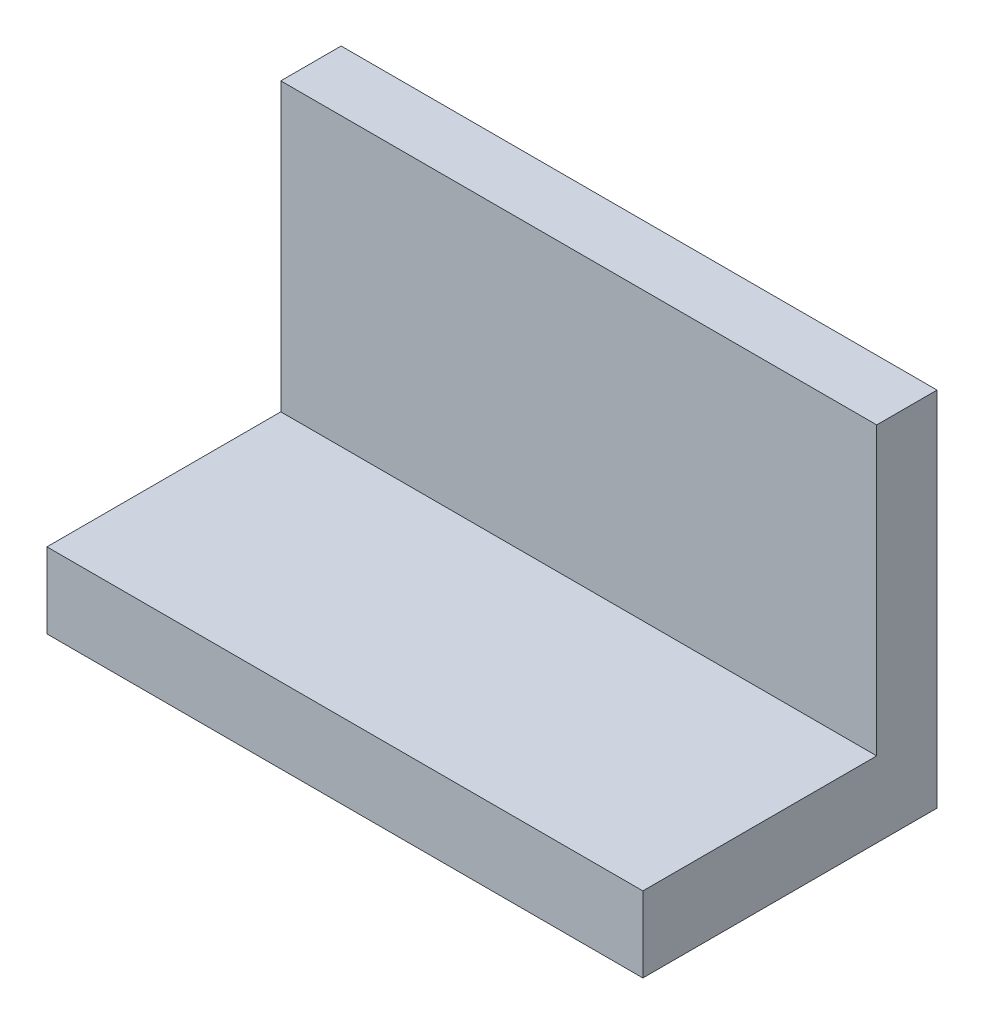
from build123d import *

# Parameters (mm, degrees)
SKETCH_1_W          = 15.8
SKETCH_1_H          = 7.8
EXTRUDE_1_DEPTH     = 9.6
SKETCH_2_W          = 15.8
SKETCH_2_H          = 6.199999898
CUT_EXTRUDE_1_DEPTH = 7.6
SKETCH_3_R          = 2.5
CUT_EXTRUDE_2_DEPTH = 1.8


with BuildPart() as part:
    # Эскиз1 → Бобышка-Вытянуть1 (new body)
    with BuildSketch(Plane(origin=(0, 0, 0), x_dir=(1, 0, 0), z_dir=(0, 1, 0))):
        Rectangle(SKETCH_1_W, SKETCH_1_H)
    extrude(amount=EXTRUDE_1_DEPTH)

    # Эскиз2 → Вырез-Вытянуть1 (cut)
    with BuildSketch(Plane(origin=(0, 9.6, 0), x_dir=(1, 0, 0), z_dir=(0, 1, 0))):
        with Locations((0, -0.800000051)):
            Rectangle(SKETCH_2_W, SKETCH_2_H)
    extrude(amount=-CUT_EXTRUDE_1_DEPTH, mode=Mode.SUBTRACT)

    # Эскиз3 → Вырез-Вытянуть2 (cut)
    with BuildSketch(Plane.XZ):
        with Locations(Location((-4, -7.4e-08, 0), (0, 0, 270))):
            Circle(SKETCH_3_R)
        with Locations(Location((3.874, -7.4e-08, 0), (0, 0, 270))):
            Circle(SKETCH_3_R)
    extrude(amount=-CUT_EXTRUDE_2_DEPTH, mode=Mode.SUBTRACT)


solid = part.part
